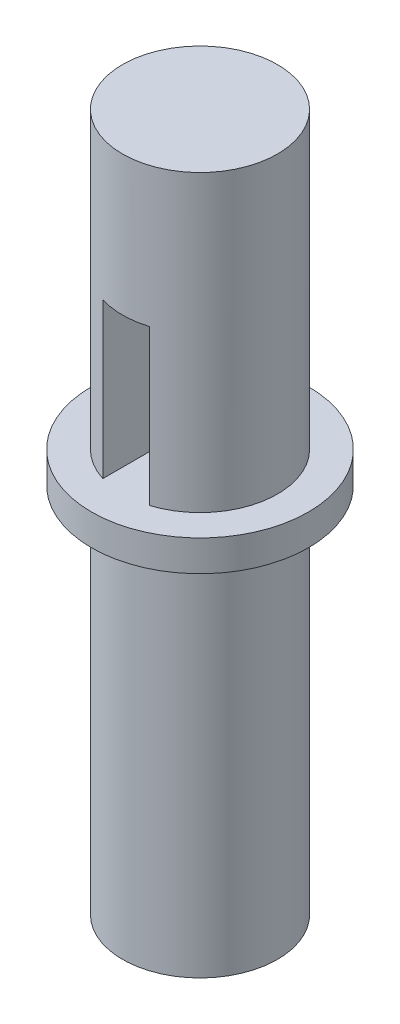
from build123d import *

# Parameters (mm, degrees)
SKETCH1_R           = 5
BOSS_EXTRUDE1_DEPTH = 60
SKETCH2_W           = 3
SKETCH2_H           = 10
CUT_EXTRUDE2_DEPTH  = 30
SKETCH3_R           = 5
CUT_EXTRUDE3_DEPTH  = 15
BOSS_EXTRUDE2_START = -26
SKETCH4_R           = 7
BOSS_EXTRUDE2_DEPTH = 2


with BuildPart() as part:
    # Sketch1 → Boss-Extrude1 (new body)
    with BuildSketch(Plane(origin=(0, 0, 0), x_dir=(1, 0, 0), z_dir=(0, 1, 0))):
        with Locations(Location((1.609928916, 0, 0), (0, 0, 270))):
            Circle(SKETCH1_R)
    extrude(amount=BOSS_EXTRUDE1_DEPTH)

    # Sketch2 → Cut-Extrude2 (cut, symmetric)
    with BuildSketch(Plane.XY):
        with Locations((1.609928916, 46)):
            Rectangle(SKETCH2_W, SKETCH2_H)
    extrude(amount=CUT_EXTRUDE2_DEPTH, both=True, mode=Mode.SUBTRACT)

    # Sketch3 → Cut-Extrude3 (cut)
    with BuildSketch(Plane.XZ):
        with Locations(Location((1.609928916, 0, 0), (0, 0, 270))):
            Circle(SKETCH3_R)
    extrude(amount=-CUT_EXTRUDE3_DEPTH, mode=Mode.SUBTRACT)

    # Sketch4 → Boss-Extrude2 (add)
    with BuildSketch(Plane.XZ.offset(-15).offset(BOSS_EXTRUDE2_START)):
        with Locations(Location((1.609928916, 0, 0), (0, 0, 270))):
            Circle(SKETCH4_R)
    extrude(amount=BOSS_EXTRUDE2_DEPTH)


solid = part.part
